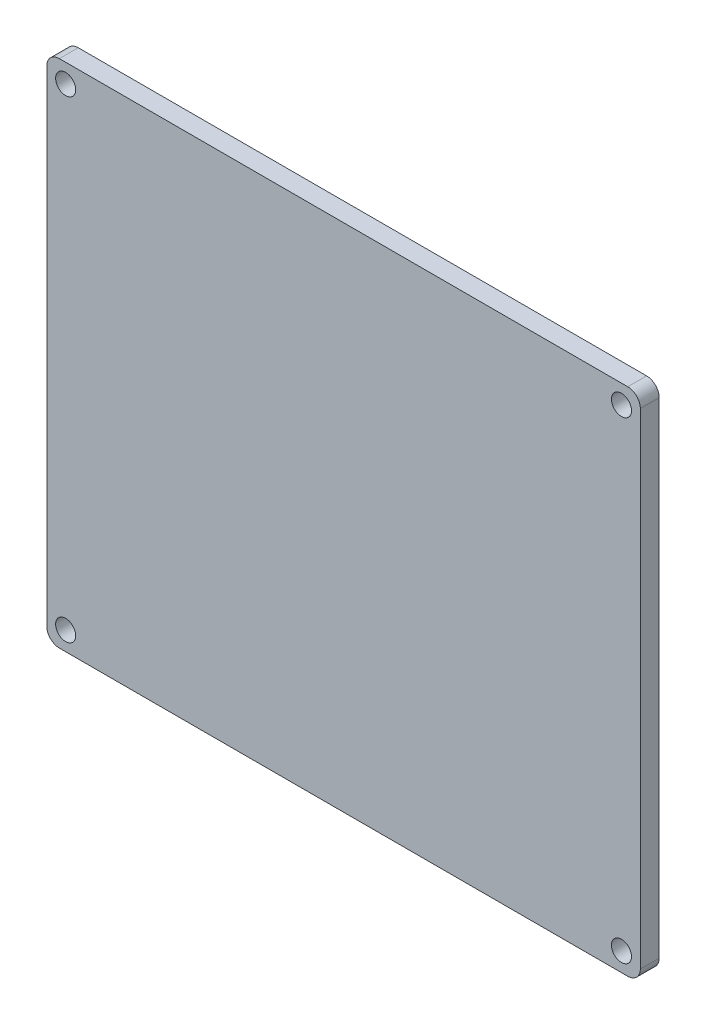
from build123d import *

# Parameters (mm, degrees)
SKETCH_1_W      = 94.4
SKETCH_1_H      = 81.2
SKETCH_1_R      = 1.6
EXTRUDE_1_DEPTH = 3
FILLET_1_R      = 2


with BuildPart() as part:
    # 草图1 → 凸台-拉伸1 (new body)
    with BuildSketch(Plane.XY):
        Rectangle(SKETCH_1_W, SKETCH_1_H)
        with Locations((44.2, 37.6)):
            Circle(SKETCH_1_R, mode=Mode.SUBTRACT)
        with Locations((44.2, -37.6)):
            Circle(SKETCH_1_R, mode=Mode.SUBTRACT)
        with Locations((-44.2, 37.6)):
            Circle(SKETCH_1_R, mode=Mode.SUBTRACT)
        with Locations((-44.2, -37.6)):
            Circle(SKETCH_1_R, mode=Mode.SUBTRACT)
    extrude(amount=EXTRUDE_1_DEPTH)

    # 圆角1
    fillet_1_edges = [part.edges().sort_by_distance(p)[0] for p in [
        (47.2, -40.6, 1.5),
        (-47.2, -40.6, 1.5),
        (-47.2, 40.6, 1.5),
        (47.2, 40.6, 1.5),
    ]]
    fillet(fillet_1_edges, radius=FILLET_1_R)


solid = part.part
